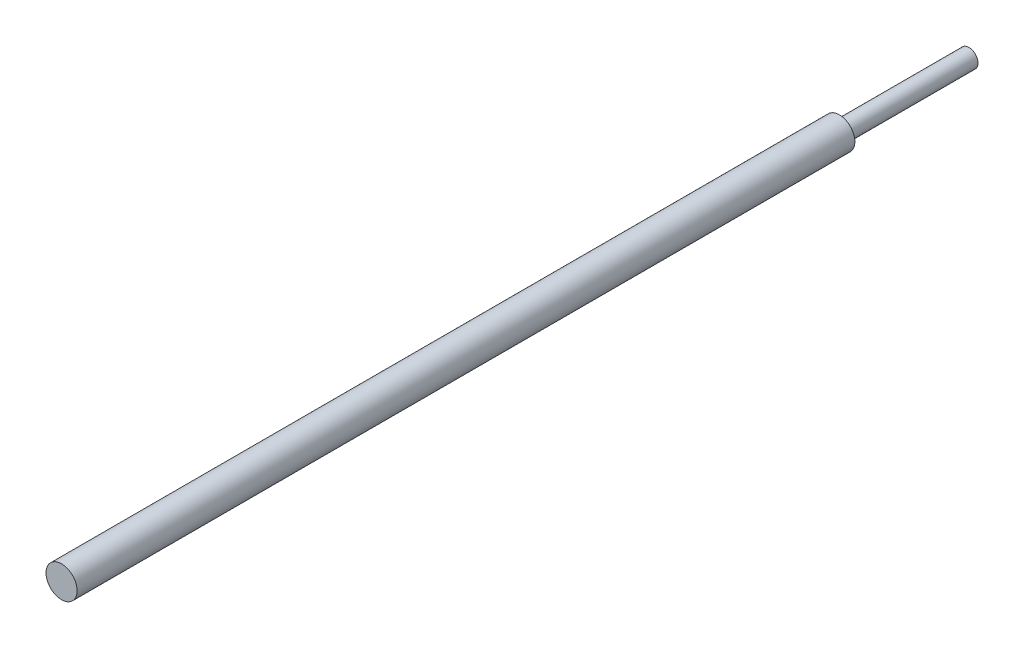
from build123d import *

# Parameters (mm, degrees)
SKETCH_1_R      = 0.35
EXTRUDE_1_DEPTH = 5
SKETCH_2_R      = 0.6
EXTRUDE_2_DEPTH = 30


with BuildPart() as part:
    # Эскиз1 → Вытянуть1 (new body)
    with BuildSketch(Plane.XY):
        with Locations(Location((0, 0, 0), (0, 0, 180))):
            Circle(SKETCH_1_R)
    extrude(amount=EXTRUDE_1_DEPTH)

    # Эскиз2 → Вытянуть2 (add)
    with BuildSketch(Plane.XY.offset(5)):
        with Locations(Location((0, 0, 0), (0, 0, 180))):
            Circle(SKETCH_2_R)
    extrude(amount=EXTRUDE_2_DEPTH)


solid = part.part
